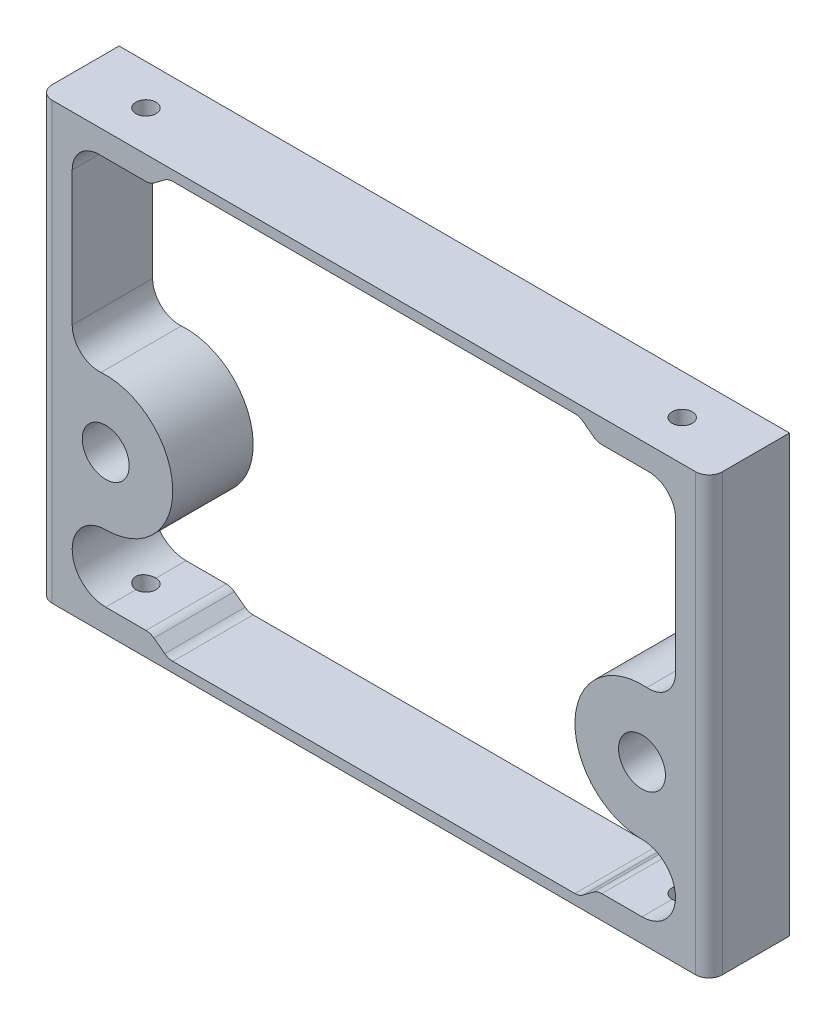
from build123d import *

# Parameters (mm, degrees)
SKETCH_1_W          = 100
SKETCH_1_H          = 65
EXTRUDE_1_DEPTH     = 12
SKETCH_2_R          = 3.5
CUT_EXTRUDE_1_DEPTH = 61.829680256
SKETCH_3_R          = 1.5
CUT_EXTRUDE_2_DEPTH = 10
CUT_EXTRUDE_START   = -10
SKETCH_4_R          = 1.5
CUT_EXTRUDE_3_DEPTH = 10
FILLET_1_R          = 2


with BuildPart() as part:
    # 草图1 → 凸台-拉伸1 (new body)
    with BuildSketch(Plane.XY):
        Rectangle(SKETCH_1_W, SKETCH_1_H)
    extrude(amount=EXTRUDE_1_DEPTH)

    # 草图2 → 切除-拉伸1 (cut, through all)
    with BuildSketch(Plane.XY.offset(12)):
        with Locations((-40, -9)):
            Circle(SKETCH_2_R)
        with Locations((40, -9)):
            Circle(SKETCH_2_R)
        with BuildLine():
            Line((30, 31), (-30, 31))
            ThreePointArc((-30, 31), (-30.632455532, 30.897366596), (-31.2, 30.6))
            Line((-31.2, 30.6), (-32.8, 29.4))
            ThreePointArc((-32.8, 29.4), (-33.367544468, 29.102633404), (-34, 29))
            Line((-34, 29), (-41, 29))
            ThreePointArc((-41, 29), (-43.828427125, 27.828427125), (-45, 25))
            Line((-45, 25), (-45, 4.964240044))
            ThreePointArc((-45, 4.964240044), (-43.725540575, 2.036539825), (-40.714285714, 0.974457174))
            ThreePointArc((-40.714285714, 0.974457174), (-30.006387747, -8.642628863), (-40, -19))
            ThreePointArc((-40, -19), (-45, -24), (-40, -29))
            Line((-40, -29), (-34, -29))
            ThreePointArc((-34, -29), (-33.367544468, -29.102633404), (-32.8, -29.4))
            Line((-32.8, -29.4), (-31.2, -30.6))
            ThreePointArc((-31.2, -30.6), (-30.632455532, -30.897366596), (-30, -31))
            Line((-30, -31), (30, -31))
            ThreePointArc((30, -31), (30.632455532, -30.897366596), (31.2, -30.6))
            Line((31.2, -30.6), (32.8, -29.4))
            ThreePointArc((32.8, -29.4), (33.367544468, -29.102633404), (34, -29))
            Line((34, -29), (40, -29))
            ThreePointArc((40, -29), (45, -24), (40, -19))
            ThreePointArc((40, -19), (30.006387747, -8.642628863), (40.714285714, 0.974457174))
            ThreePointArc((40.714285714, 0.974457174), (43.725540575, 2.036539825), (45, 4.964240044))
            Line((45, 4.964240044), (45, 25))
            ThreePointArc((45, 25), (43.828427125, 27.828427125), (41, 29))
            Line((41, 29), (34, 29))
            ThreePointArc((34, 29), (33.367544468, 29.102633404), (32.8, 29.4))
            Line((32.8, 29.4), (31.2, 30.6))
            ThreePointArc((31.2, 30.6), (30.632455532, 30.897366596), (30, 31))
        make_face()
    extrude(amount=-CUT_EXTRUDE_1_DEPTH, mode=Mode.SUBTRACT)

    # 草图3 → 切除-拉伸2 (cut)
    with BuildSketch(Plane(origin=(0, 32.5, 0), x_dir=(1, 0, 0), z_dir=(0, 1, 0))):
        with Locations(Location((40, -6, 0), (0, 0, 270))):
            Circle(SKETCH_3_R)
    cut_extrude_2 = extrude(amount=-CUT_EXTRUDE_2_DEPTH, mode=Mode.SUBTRACT)

    # 草图4 → 切除-拉伸3 (cut)
    with BuildSketch(Plane.XZ.offset(32.5).offset(CUT_EXTRUDE_START)):
        with Locations(Location((40, 6, 0), (0, 0, 90))):
            Circle(SKETCH_4_R)
    cut_extrude_3 = extrude(amount=CUT_EXTRUDE_3_DEPTH, mode=Mode.SUBTRACT)

    # 镜向1: 切除-拉伸2, 切除-拉伸3 across plane
    add(cut_extrude_2.mirror(Plane(origin=(0, 0, 0), x_dir=(0, 0, 1), z_dir=(1, 0, 0))), mode=Mode.SUBTRACT)
    add(cut_extrude_3.mirror(Plane(origin=(0, 0, 0), x_dir=(0, 0, 1), z_dir=(1, 0, 0))), mode=Mode.SUBTRACT)

    # 圆角1
    fillet_1_edges = [part.edges().sort_by_distance(p)[0] for p in [
        (-50, 0, 12),
        (50, 0, 12),
    ]]
    fillet(fillet_1_edges, radius=FILLET_1_R)


solid = part.part
